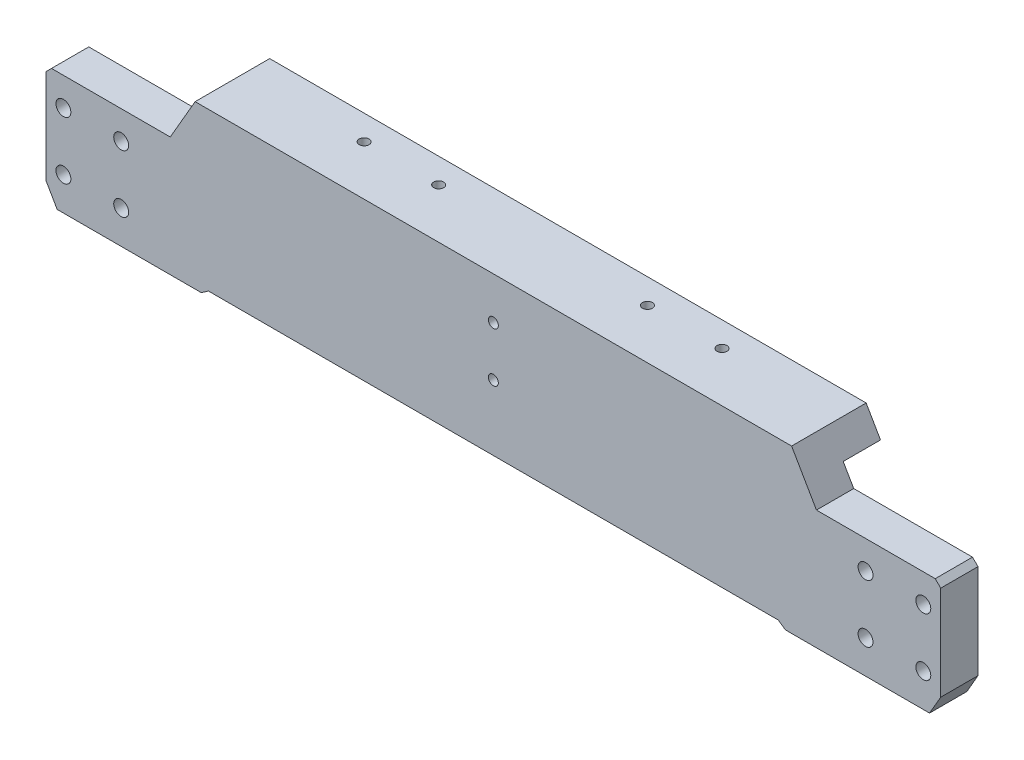
from build123d import *
from build123d.topology import SkipClean

# Parameters (mm, degrees)
SKETCH1_R               = 3
SKETCH1_R_2             = 2
BOSS_EXTRUDE1_DEPTH     = 15
BOSS_EXTRUDE2_START     = 15
SKETCH3_W               = 70
SKETCH3_H               = 40
SKETCH3_R               = 2
BOSS_EXTRUDE2_DEPTH     = 15
SKETCH4_R               = 2
CUT_EXTRUDE1_DEPTH      = 193.072300906
ESQUISSE1_R             = 2
ENL_V_MAT_EXTRU_1_DEPTH = 10


with BuildPart() as part:
    # Sketch1 → Boss-Extrude1 (new body)
    with BuildSketch(Plane.XY):
        Polygon((-114.627718677, 0), (114.627718677, 0), (117.5, -2), (175.5, -2), (180, 5.794228634), (180, 43.794228634), (177.794228634, 46), (130, 46), (120, 63.320508076), (-120, 63.320508076), (-130, 46), (-177.794228634, 46), (-180, 43.794228634), (-180, 5.794228634), (-175.5, -2), (-117.5, -2), align=None)
        with Locations((-173, 34.625)):
            Circle(SKETCH1_R, mode=Mode.SUBTRACT)
        with Locations((-149.75, 34.625)):
            Circle(SKETCH1_R, mode=Mode.SUBTRACT)
        with Locations((-173, 11.375)):
            Circle(SKETCH1_R, mode=Mode.SUBTRACT)
        with Locations((-149.75, 11.375)):
            Circle(SKETCH1_R, mode=Mode.SUBTRACT)
        with Locations((149.75, 34.625)):
            Circle(SKETCH1_R, mode=Mode.SUBTRACT)
        with Locations((173, 34.625)):
            Circle(SKETCH1_R, mode=Mode.SUBTRACT)
        with Locations((149.75, 11.375)):
            Circle(SKETCH1_R, mode=Mode.SUBTRACT)
        with Locations((173, 11.375)):
            Circle(SKETCH1_R, mode=Mode.SUBTRACT)
        with Locations((0, 46.320508076)):
            Circle(SKETCH1_R_2, mode=Mode.SUBTRACT)
        with Locations((0, 26.320508076)):
            Circle(SKETCH1_R_2, mode=Mode.SUBTRACT)
    extrude(amount=BOSS_EXTRUDE1_DEPTH)

    # Sketch3 → Boss-Extrude2 (add)
    # profile 1 of 2: a face of its own
    with SkipClean():  # the faces are left unmerged after this step: merging them gives an invalid solid
        with BuildSketch(Plane(origin=(0, 0, 0), x_dir=(-1, 0, 0), z_dir=(0, 0, -1)).offset(BOSS_EXTRUDE2_START)):
            with Locations((24.627718677, 33.320508076)):
                Rectangle(SKETCH3_W, SKETCH3_H)
            with Locations((0, 26.320508076)):
                Circle(SKETCH3_R, mode=Mode.SUBTRACT)
            with Locations((0, 46.320508076)):
                Circle(SKETCH3_R, mode=Mode.SUBTRACT)
        # profile 2 of 2: a face of its own
        with BuildSketch(Plane(origin=(0, 0, 0), x_dir=(-1, 0, 0), z_dir=(0, 0, -1)).offset(BOSS_EXTRUDE2_START)):
            Polygon((120, 63.320508076), (-120, 63.320508076), (-125.773502692, 53.320508076), (-10.372281323, 53.320508076), (59.627718677, 53.320508076), (125.773502692, 53.320508076), align=None)
        extrude(amount=-BOSS_EXTRUDE2_DEPTH)

    # Sketch4 → Cut-Extrude1 (cut, through all)
    with SkipClean():  # the faces are left unmerged after this step: merging them gives an invalid solid
        with BuildSketch(Plane(origin=(0, 63.320508076, 0), x_dir=(1, 0, 0), z_dir=(0, 1, 0))):
            with Locations(Location((-72, 5, 0), (0, 0, 180))):
                Circle(SKETCH4_R)
            with Locations(Location((-42, 5, 0), (0, 0, 180))):
                Circle(SKETCH4_R)
            with Locations((42, 5)):
                Circle(SKETCH4_R)
            with Locations((72, 5)):
                Circle(SKETCH4_R)
        extrude(amount=-CUT_EXTRUDE1_DEPTH, mode=Mode.SUBTRACT)

    # Esquisse1 → Enlèv. mat.-Extru.1 (cut)
    with SkipClean():  # the faces are left unmerged after this step: merging them gives an invalid solid
        with BuildSketch(Plane(origin=(0, 0, -15), x_dir=(-1, 0, 0), z_dir=(0, 0, -1))):
            with Locations((-50.372281323, 58.320508076)):
                Circle(ESQUISSE1_R)
            with Locations((-63.372281323, 58.320508076)):
                Circle(ESQUISSE1_R)
        extrude(amount=-ENL_V_MAT_EXTRU_1_DEPTH, mode=Mode.SUBTRACT)


solid = part.part
